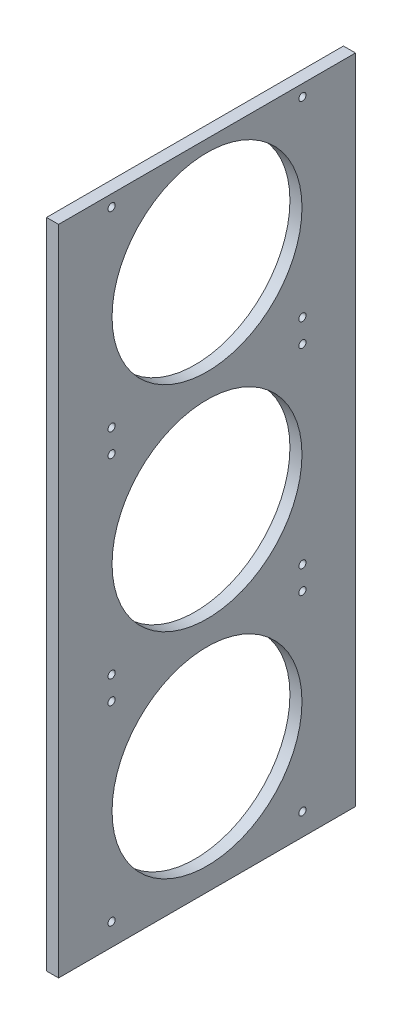
from build123d import *

# Parameters (mm, degrees)
SKETCH1_W                     = 166.5
SKETCH1_H                     = 111
BOSS_EXTRUDE1_DEPTH           = 30.5
SHELL1_T                      = -4.5
CUT_EXTRUDE1_REACH            = 105.377
SKETCH2_W                     = 157
SKETCH2_H                     = 92
TAP_DRILL_FOR_6_32_TAP1_D     = 2.7051
TAP_DRILL_FOR_6_32_TAP1_DEPTH = 4.5
LPATTERN1_COUNT               = 8
LPATTERN1_PITCH               = 30.5
SKETCH7_W                     = 102
SKETCH7_H                     = 4.5
CUT_EXTRUDE2_DEPTH            = 5
SKETCH8_W                     = 102
SKETCH8_H                     = 157
CUT_EXTRUDE3_DEPTH            = 5
CUT_EXTRUDE4_REACH            = 302.564
SKETCH9_R                     = 35.5
TAP_DRILL_FOR_6_32_TAP2_D     = 2.7051
CUT_EXTRUDE6_START            = -162
SKETCH14_W                    = 111
SKETCH14_H                    = 244
CUT_EXTRUDE6_DEPTH            = 162


with BuildPart() as part:
    # Sketch1 → Boss-Extrude1 (new body)
    with BuildSketch(Plane(origin=(0, 0, 0), x_dir=(1, 0, 0), z_dir=(0, 1, 0))):
        Rectangle(SKETCH1_W, SKETCH1_H)
    extrude(amount=BOSS_EXTRUDE1_DEPTH)

    # Shell1
    shell1_openings = [part.faces().sort_by_distance(p)[0] for p in [
        (0, 30.5, 0),
        (-83.25, 15.25, 0),
    ]]
    offset(amount=SHELL1_T, openings=shell1_openings, kind=Kind.INTERSECTION)

    # Sketch2 → Cut-Extrude1 (cut, up to next)
    with BuildSketch(Plane(origin=(0, 4.5, 0), x_dir=(1, 0, 0), z_dir=(0, 1, 0)), mode=Mode.PRIVATE) as cut_extrude1_sk1:
        with Locations((0.25, 0)):
            Rectangle(SKETCH2_W, SKETCH2_H)
    cut_extrude1_tool1 = extrude(cut_extrude1_sk1.sketch, amount=-CUT_EXTRUDE1_REACH, mode=Mode.PRIVATE) & part.part
    add(cut_extrude1_tool1.solids().sort_by_distance((0.25, 4.5, 0))[0], mode=Mode.SUBTRACT)

    # Tap Drill for #6-32 Tap1
    with Locations(Plane(origin=(0, 0, -55.5), x_dir=(-1, 0, 0), z_dir=(0, 0, -1))):
        with Locations((42.66, 10.84), (-58.75, 10.84)):
            tap_drill_for_6_32_tap1 = Hole(TAP_DRILL_FOR_6_32_TAP1_D / 2, depth=TAP_DRILL_FOR_6_32_TAP1_DEPTH)

    # Mirror1: Tap Drill for #6-32 Tap1 across plane
    add(tap_drill_for_6_32_tap1.mirror(Plane.XY), mode=Mode.SUBTRACT)


with BuildPart() as lpattern1_1:
    # LPattern1: pattern copy
    add(part.part.moved(Location(Vector(0, 1, 0) * (1 * LPATTERN1_PITCH))))


with BuildPart() as lpattern1_2:
    # LPattern1: pattern copy
    add(part.part.moved(Location(Vector(0, 1, 0) * (2 * LPATTERN1_PITCH))))


with BuildPart() as lpattern1_3:
    # LPattern1: pattern copy
    add(part.part.moved(Location(Vector(0, 1, 0) * (3 * LPATTERN1_PITCH))))


with BuildPart() as lpattern1_4:
    # LPattern1: pattern copy
    add(part.part.moved(Location(Vector(0, 1, 0) * (4 * LPATTERN1_PITCH))))


with BuildPart() as lpattern1_5:
    # LPattern1: pattern copy
    add(part.part.moved(Location(Vector(0, 1, 0) * (5 * LPATTERN1_PITCH))))


with BuildPart() as lpattern1_6:
    # LPattern1: pattern copy
    add(part.part.moved(Location(Vector(0, 1, 0) * (6 * LPATTERN1_PITCH))))


with BuildPart() as lpattern1_7:
    # LPattern1: pattern copy
    add(part.part.moved(Location(Vector(0, 1, 0) * (7 * LPATTERN1_PITCH))))


with BuildPart() as part_1:
    add(part.part)

    # Combine1: union LPattern1_1
    add(lpattern1_1.part)

    # Sketch7 → Cut-Extrude2 (cut)
    with BuildSketch(Plane.ZY.offset(83.25)):
        with Locations((0, 32.75)):
            Rectangle(SKETCH7_W, SKETCH7_H)
    extrude(amount=-CUT_EXTRUDE2_DEPTH, mode=Mode.SUBTRACT)


with BuildPart() as lpattern1_2_1:
    add(lpattern1_2.part)

    # Combine2: union LPattern1_3, LPattern1_5, LPattern1_4, LPattern1_7, part, LPattern1_6
    add(lpattern1_3.part)
    add(lpattern1_5.part)
    add(lpattern1_4.part)
    add(lpattern1_7.part)
    add(part_1.part)
    add(lpattern1_6.part)

    # Sketch8 → Cut-Extrude3 (cut)
    with BuildSketch(Plane.ZY.offset(83.25)):
        with Locations((0, 139.5)):
            Rectangle(SKETCH8_W, SKETCH8_H)
    extrude(amount=-CUT_EXTRUDE3_DEPTH, mode=Mode.SUBTRACT)

    # Sketch9 → Cut-Extrude4 (cut, up to next)
    with BuildSketch(Plane(origin=(83.25, 0, 0), x_dir=(0, 0, -1), z_dir=(1, 0, 0)), mode=Mode.PRIVATE) as cut_extrude4_sk1:
        with Locations((0, 204)):
            Circle(SKETCH9_R)
    cut_extrude4_tool1 = extrude(cut_extrude4_sk1.sketch, amount=-CUT_EXTRUDE4_REACH, mode=Mode.PRIVATE) & lpattern1_2_1.part
    # Sketch9 → Cut-Extrude4 (cut, up to next)
    with BuildSketch(Plane(origin=(83.25, 0, 0), x_dir=(0, 0, -1), z_dir=(1, 0, 0)), mode=Mode.PRIVATE) as cut_extrude4_sk2:
        with Locations((0, 124)):
            Circle(SKETCH9_R)
    cut_extrude4_tool2 = extrude(cut_extrude4_sk2.sketch, amount=-CUT_EXTRUDE4_REACH, mode=Mode.PRIVATE) & lpattern1_2_1.part
    # Sketch9 → Cut-Extrude4 (cut, up to next)
    with BuildSketch(Plane(origin=(83.25, 0, 0), x_dir=(0, 0, -1), z_dir=(1, 0, 0)), mode=Mode.PRIVATE) as cut_extrude4_sk3:
        with Locations((0, 44)):
            Circle(SKETCH9_R)
    cut_extrude4_tool3 = extrude(cut_extrude4_sk3.sketch, amount=-CUT_EXTRUDE4_REACH, mode=Mode.PRIVATE) & lpattern1_2_1.part
    add(cut_extrude4_tool1.solids().sort_by_distance((83.25, 204, 0))[0], mode=Mode.SUBTRACT)
    add(cut_extrude4_tool2.solids().sort_by_distance((83.25, 124, 0))[0], mode=Mode.SUBTRACT)
    add(cut_extrude4_tool3.solids().sort_by_distance((83.25, 44, 0))[0], mode=Mode.SUBTRACT)

    # Tap Drill for #6-32 Tap2 (through all)
    with Locations(Plane(origin=(83.25, 0, 0), x_dir=(0, 0, -1), z_dir=(1, 0, 0))):
        with Locations((-35.675, 239.675), (35.675, 239.675), (35.675, 168.325), (-35.675, 168.325)):
            tap_drill_for_6_32_tap2 = Hole(TAP_DRILL_FOR_6_32_TAP2_D / 2)

    # Mirror2: Tap Drill for #6-32 Tap2 across plane
    add(tap_drill_for_6_32_tap2.mirror(Plane.ZX.offset(164)), mode=Mode.SUBTRACT)

    # Mirror3: Tap Drill for #6-32 Tap2 across plane
    add(tap_drill_for_6_32_tap2.mirror(Plane.ZX.offset(124)), mode=Mode.SUBTRACT)

    # Sketch14 → Cut-Extrude6 (cut)
    with BuildSketch(Plane.ZY.offset(83.25).offset(CUT_EXTRUDE6_START)):
        with Locations((0, 122)):
            Rectangle(SKETCH14_W, SKETCH14_H)
    extrude(amount=CUT_EXTRUDE6_DEPTH, mode=Mode.SUBTRACT)


solid = lpattern1_2_1.part
